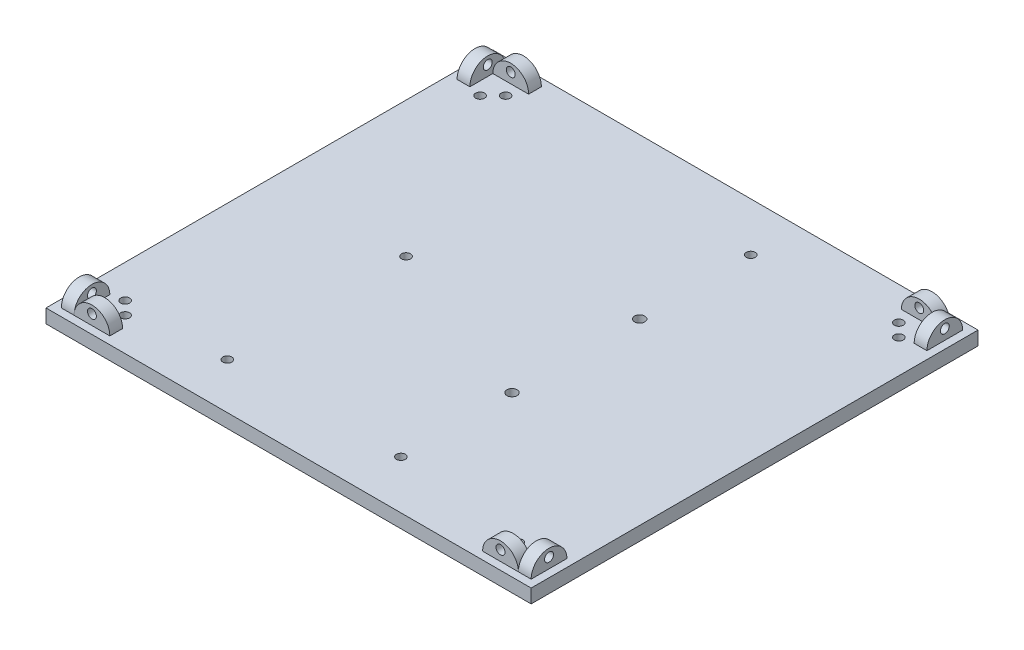
from build123d import *

# Parameters (mm, degrees)
SKETCH1_W                   = 190
SKETCH1_H                   = 175
SKETCH1_R                   = 2
SKETCH1_R_2                 = 1.75
BASE_DEPTH                  = 5.4
SKETCH3_R                   = 1.75
LONG_SIDE_CONNECTORS_DEPTH  = 5
SHORT_SIDE_CONNECTORS_DEPTH = 5
MIRROR3_COPY_1_DEPTH        = 5
CUT_EXTRUDE6_START          = -5.4
SKETCH11_R                  = 1.75
CUT_EXTRUDE6_DEPTH          = 179.761105811


with BuildPart() as part:
    # Sketch1 → Base (new body)
    with BuildSketch(Plane(origin=(0, 0, 0), x_dir=(1, 0, 0), z_dir=(0, 1, 0))):
        with Locations((-51.064381671, 5.614281477)):
            Rectangle(SKETCH1_W, SKETCH1_H)
        with Locations(Location((-26.064381671, 30.614281477, 0), (0, 0, 270))):
            Circle(SKETCH1_R, mode=Mode.SUBTRACT)
        with Locations(Location((-26.064381671, -19.385718523, 0), (0, 0, 270))):
            Circle(SKETCH1_R, mode=Mode.SUBTRACT)
        with Locations(Location((-26.064381671, -62.885718523, 0), (0, 0, 270))):
            Circle(SKETCH1_R_2, mode=Mode.SUBTRACT)
        with Locations(Location((-26.064381671, 74.114281477, 0), (0, 0, 270))):
            Circle(SKETCH1_R_2, mode=Mode.SUBTRACT)
        with Locations(Location((-93.064381671, 6.114281477, 0), (0, 0, 270))):
            Circle(SKETCH1_R_2, mode=Mode.SUBTRACT)
        with Locations(Location((-93.064381671, -63.885718523, 0), (0, 0, 270))):
            Circle(SKETCH1_R_2, mode=Mode.SUBTRACT)
    extrude(amount=-BASE_DEPTH)

    # Sketch3 → Long_Side_connectors (add)
    # profile 1 of 2: a face of its own
    with BuildSketch(Plane(origin=(-143.064381671, 0, 0), x_dir=(0, 0, -1), z_dir=(1, 0, 0))):
        with BuildLine():
            Line((76.114281477, 0), (90.114281477, 0))
            ThreePointArc((90.114281477, 0), (83.114281477, 7), (76.114281477, 0))
        make_face()
        with Locations((83.114281477, 4)):
            Circle(SKETCH3_R, mode=Mode.SUBTRACT)
    # profile 2 of 2: a face of its own
    with BuildSketch(Plane(origin=(-143.064381671, 0, 0), x_dir=(0, 0, -1), z_dir=(1, 0, 0))):
        with BuildLine():
            Line((-78.885718523, 0), (-64.885718523, 0))
            ThreePointArc((-64.885718523, 0), (-71.885718523, 7), (-78.885718523, 0))
        make_face()
        with Locations((-71.885718523, 4)):
            Circle(SKETCH3_R, mode=Mode.SUBTRACT)
    long_side_connectors = extrude(amount=LONG_SIDE_CONNECTORS_DEPTH)

    # Sketch4 → Short_side_connectors (add)
    with BuildSketch(Plane.XY.offset(78.885718523)):
        with BuildLine():
            ThreePointArc((-131.064381671, 7), (-136.014129139, 4.949747468), (-138.064381671, 0))
            Line((-138.064381671, 0), (-131.064381671, 0))
            Line((-131.064381671, 0), (-131.064381671, 2.25))
            ThreePointArc((-131.064381671, 2.25), (-132.814381671, 4), (-131.064381671, 5.75))
            Line((-131.064381671, 5.75), (-131.064381671, 7))
        make_face()
        with BuildLine():
            Line((-131.064381671, 2.25), (-131.064381671, 0))
            Line((-131.064381671, 0), (-124.064381671, 0))
            ThreePointArc((-124.064381671, 0), (-126.114634203, 4.949747468), (-131.064381671, 7))
            Line((-131.064381671, 7), (-131.064381671, 5.75))
            ThreePointArc((-131.064381671, 5.75), (-129.826944804, 5.237436867), (-129.314381671, 4))
            ThreePointArc((-129.314381671, 4), (-129.826944804, 2.762563133), (-131.064381671, 2.25))
        make_face()
        with BuildLine():
            ThreePointArc((-131.064381671, 7), (-136.014129139, 4.949747468), (-138.064381671, 0))
            Line((-138.064381671, 0), (-131.064381671, 0))
            Line((-131.064381671, 0), (-131.064381671, 2.25))
            ThreePointArc((-131.064381671, 2.25), (-132.814381671, 4), (-131.064381671, 5.75))
            Line((-131.064381671, 5.75), (-131.064381671, 7))
        make_face()
        with BuildLine():
            Line((-131.064381671, 2.25), (-131.064381671, 0))
            Line((-131.064381671, 0), (-124.064381671, 0))
            ThreePointArc((-124.064381671, 0), (-126.114634203, 4.949747468), (-131.064381671, 7))
            Line((-131.064381671, 7), (-131.064381671, 5.75))
            ThreePointArc((-131.064381671, 5.75), (-129.826944804, 5.237436867), (-129.314381671, 4))
            ThreePointArc((-129.314381671, 4), (-129.826944804, 2.762563133), (-131.064381671, 2.25))
        make_face()
    short_side_connectors = extrude(amount=-SHORT_SIDE_CONNECTORS_DEPTH)

    # Mirror1: Short_side_connectors across plane
    add(short_side_connectors.mirror(Plane.XY.offset(-5.614281477)))

    # Mirror3: Long_Side_connectors, Short_side_connectors across plane
    add(long_side_connectors.mirror(Plane(origin=(-51.064381671, 0, 0), x_dir=(0, 0, 1), z_dir=(1, 0, 0))))
    add(short_side_connectors.mirror(Plane(origin=(-51.064381671, 0, 0), x_dir=(0, 0, 1), z_dir=(1, 0, 0))))

    # Mirror3 copy 1 sketch → Mirror3 copy 1 (add)
    with BuildSketch(Plane(origin=(-102.128763342, 0, -90.114281477), x_dir=(-1, 0, 0), z_dir=(0, 0, -1))):
        with BuildLine():
            ThreePointArc((-131.064381671, 7), (-136.014129139, 4.949747468), (-138.064381671, 0))
            Line((-138.064381671, 0), (-131.064381671, 0))
            Line((-131.064381671, 0), (-131.064381671, 2.25))
            ThreePointArc((-131.064381671, 2.25), (-132.814381671, 4), (-131.064381671, 5.75))
            Line((-131.064381671, 5.75), (-131.064381671, 7))
        make_face()
        with BuildLine():
            Line((-131.064381671, 2.25), (-131.064381671, 0))
            Line((-131.064381671, 0), (-124.064381671, 0))
            ThreePointArc((-124.064381671, 0), (-126.114634203, 4.949747468), (-131.064381671, 7))
            Line((-131.064381671, 7), (-131.064381671, 5.75))
            ThreePointArc((-131.064381671, 5.75), (-129.826944804, 5.237436867), (-129.314381671, 4))
            ThreePointArc((-129.314381671, 4), (-129.826944804, 2.762563133), (-131.064381671, 2.25))
        make_face()
        with BuildLine():
            ThreePointArc((-131.064381671, 7), (-136.014129139, 4.949747468), (-138.064381671, 0))
            Line((-138.064381671, 0), (-131.064381671, 0))
            Line((-131.064381671, 0), (-131.064381671, 2.25))
            ThreePointArc((-131.064381671, 2.25), (-132.814381671, 4), (-131.064381671, 5.75))
            Line((-131.064381671, 5.75), (-131.064381671, 7))
        make_face()
        with BuildLine():
            Line((-131.064381671, 2.25), (-131.064381671, 0))
            Line((-131.064381671, 0), (-124.064381671, 0))
            ThreePointArc((-124.064381671, 0), (-126.114634203, 4.949747468), (-131.064381671, 7))
            Line((-131.064381671, 7), (-131.064381671, 5.75))
            ThreePointArc((-131.064381671, 5.75), (-129.826944804, 5.237436867), (-129.314381671, 4))
            ThreePointArc((-129.314381671, 4), (-129.826944804, 2.762563133), (-131.064381671, 2.25))
        make_face()
    extrude(amount=-MIRROR3_COPY_1_DEPTH)

    # Sketch11 → Cut-Extrude6 (cut, through all)
    with BuildSketch(Plane(origin=(0, 0, 0), x_dir=(1, 0, 0), z_dir=(0, 1, 0)).offset(CUT_EXTRUDE6_START)):
        with Locations(Location((-133.064381671, -63.885718523, 0), (0, 0, 90))):
            Circle(SKETCH11_R)
        with Locations(Location((-128.064381671, -68.885718523, 0), (0, 0, 90))):
            Circle(SKETCH11_R)
        with Locations(Location((-133.064381671, 75.114281477, 0), (0, 0, 90))):
            Circle(SKETCH11_R)
        with Locations(Location((-128.064381671, 80.114281477, 0), (0, 0, 90))):
            Circle(SKETCH11_R)
        with Locations(Location((30.935618329, -63.885718523, 0), (0, 0, 90))):
            Circle(SKETCH11_R)
        with Locations(Location((25.935618329, -68.885718523, 0), (0, 0, 90))):
            Circle(SKETCH11_R)
        with Locations(Location((30.935618329, 75.114281477, 0), (0, 0, 90))):
            Circle(SKETCH11_R)
        with Locations(Location((25.935618329, 80.114281477, 0), (0, 0, 90))):
            Circle(SKETCH11_R)
    extrude(amount=CUT_EXTRUDE6_DEPTH, mode=Mode.SUBTRACT)


solid = part.part
